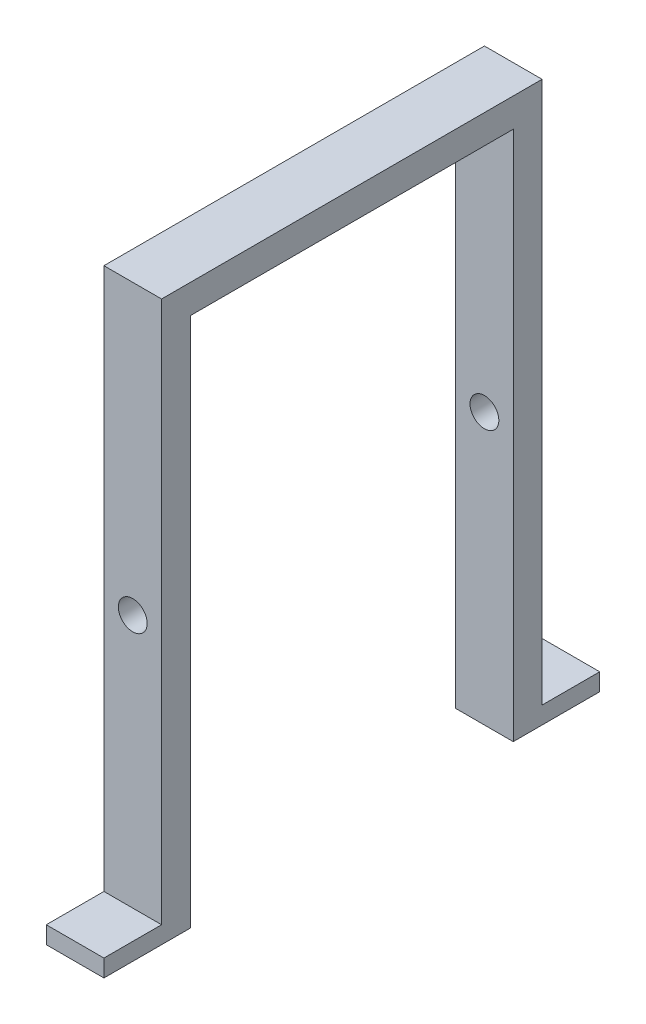
from build123d import *

# Parameters (mm, degrees)
BOSS_EXTRUDE1_DEPTH      = 5
BOSS_EXTRUDE1_DEPTH_BACK = 5
SKETCH2_R                = 2.5
CUT_EXTRUDE1_DEPTH       = 124.328828747


with BuildPart() as part:
    # Sketch1 → Boss-Extrude1 (new, two sides: drawn at the far end of the back side and taken through both)
    with BuildSketch(Plane(origin=(0, 0, 0), x_dir=(0, 0, -1), z_dir=(1, 0, 0)).offset(-BOSS_EXTRUDE1_DEPTH_BACK)):
        Polygon((-33, 3), (-33, 97), (33, 97), (33, 3), (43, 3), (43, 0), (33, 0), (28, 0), (28, 92), (-28, 92), (-28, 0), (-33, 0), (-43, 0), (-43, 3), align=None)
    extrude(amount=BOSS_EXTRUDE1_DEPTH + BOSS_EXTRUDE1_DEPTH_BACK)

    # Sketch2 → Cut-Extrude1 (cut, through all)
    with BuildSketch(Plane.XY.offset(33)):
        with Locations((0, 47)):
            Circle(SKETCH2_R)
    extrude(amount=-CUT_EXTRUDE1_DEPTH, mode=Mode.SUBTRACT)


solid = part.part
